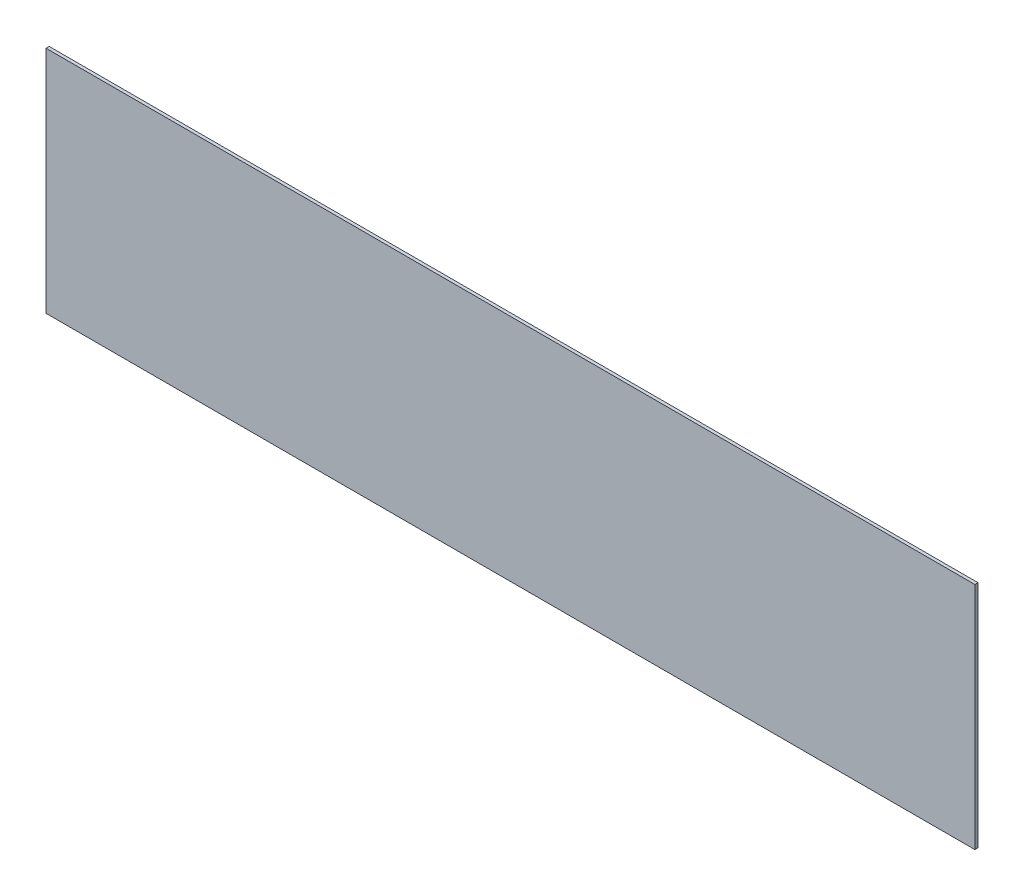
from build123d import *

# Parameters (mm, degrees)
SKETCH2_W           = 890
SKETCH2_H           = 220
BOSS_EXTRUDE1_DEPTH = 3


with BuildPart() as part:
    # Sketch2 → Boss-Extrude1 (new body)
    with BuildSketch(Plane.XY):
        Rectangle(SKETCH2_W, SKETCH2_H)
    extrude(amount=BOSS_EXTRUDE1_DEPTH)


solid = part.part
